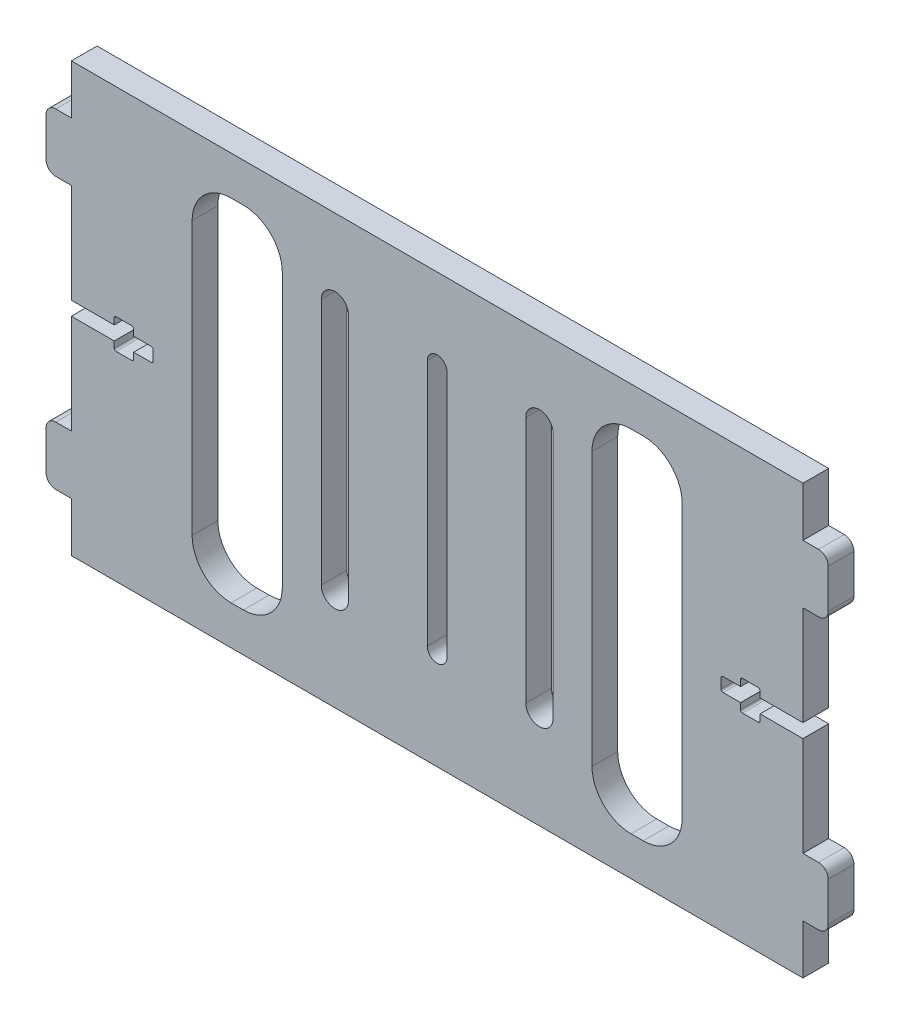
from build123d import *

# Parameters (mm, degrees)
BOSS_EXTRUDE1_DEPTH = 6.6


with BuildPart() as part:
    # Model → Boss-Extrude1 (new body)
    with BuildSketch(Plane.XY):
        with BuildLine():
            Line((72.9, 1.275), (72.9, -1.275))
            ThreePointArc((72.9, -1.275), (73.046446609, -1.628553391), (73.4, -1.775))
            Line((73.4, -1.775), (77.9, -1.775))
            Line((77.9, -1.775), (77.9, -3.36))
            ThreePointArc((77.9, -3.36), (78.046446609, -3.713553391), (78.4, -3.86))
            Line((78.4, -3.86), (82.4, -3.86))
            ThreePointArc((82.4, -3.86), (82.753553391, -3.713553391), (82.9, -3.36))
            Line((82.9, -3.36), (82.9, -1.775))
            Line((82.9, -1.775), (93.9, -1.775))
            Line((93.9, -1.775), (93.9, -27.3))
            Line((93.9, -27.3), (97.9, -27.3))
            ThreePointArc((97.9, -27.3), (99.667766953, -28.032233047), (100.4, -29.8))
            Line((100.4, -29.8), (100.4, -39.8))
            ThreePointArc((100.4, -39.8), (99.667766953, -41.567766953), (97.9, -42.3))
            Line((97.9, -42.3), (93.9, -42.3))
            Line((93.9, -42.3), (93.9, -55))
            Line((93.9, -55), (-93.9, -55))
            Line((-93.9, -55), (-93.9, -42.3))
            Line((-93.9, -42.3), (-97.9, -42.3))
            ThreePointArc((-97.9, -42.3), (-99.667766953, -41.567766953), (-100.4, -39.8))
            Line((-100.4, -39.8), (-100.4, -29.8))
            ThreePointArc((-100.4, -29.8), (-99.667766953, -28.032233047), (-97.9, -27.3))
            Line((-97.9, -27.3), (-93.9, -27.3))
            Line((-93.9, -27.3), (-93.9, -1.775))
            Line((-93.9, -1.775), (-82.9, -1.775))
            Line((-82.9, -1.775), (-82.9, -3.36))
            ThreePointArc((-82.9, -3.36), (-82.753553391, -3.713553391), (-82.4, -3.86))
            Line((-82.4, -3.86), (-78.4, -3.86))
            ThreePointArc((-78.4, -3.86), (-78.046446609, -3.713553391), (-77.9, -3.36))
            Line((-77.9, -3.36), (-77.9, -1.775))
            Line((-77.9, -1.775), (-73.4, -1.775))
            ThreePointArc((-73.4, -1.775), (-73.046446609, -1.628553391), (-72.9, -1.275))
            Line((-72.9, -1.275), (-72.9, 1.275))
            ThreePointArc((-72.9, 1.275), (-73.046446609, 1.628553391), (-73.4, 1.775))
            Line((-73.4, 1.775), (-77.9, 1.775))
            Line((-77.9, 1.775), (-77.9, 3.36))
            ThreePointArc((-77.9, 3.36), (-78.046446609, 3.713553391), (-78.4, 3.86))
            Line((-78.4, 3.86), (-82.4, 3.86))
            ThreePointArc((-82.4, 3.86), (-82.753553391, 3.713553391), (-82.9, 3.36))
            Line((-82.9, 3.36), (-82.9, 1.775))
            Line((-82.9, 1.775), (-93.9, 1.775))
            Line((-93.9, 1.775), (-93.9, 27.3))
            Line((-93.9, 27.3), (-97.9, 27.3))
            ThreePointArc((-97.9, 27.3), (-99.667766953, 28.032233047), (-100.4, 29.8))
            Line((-100.4, 29.8), (-100.4, 39.8))
            ThreePointArc((-100.4, 39.8), (-99.667766953, 41.567766953), (-97.9, 42.3))
            Line((-97.9, 42.3), (-93.9, 42.3))
            Line((-93.9, 42.3), (-93.9, 55))
            Line((-93.9, 55), (93.9, 55))
            Line((93.9, 55), (93.9, 42.3))
            Line((93.9, 42.3), (97.9, 42.3))
            ThreePointArc((97.9, 42.3), (99.667766953, 41.567766953), (100.4, 39.8))
            Line((100.4, 39.8), (100.4, 29.8))
            ThreePointArc((100.4, 29.8), (99.667766953, 28.032233047), (97.9, 27.3))
            Line((97.9, 27.3), (93.9, 27.3))
            Line((93.9, 27.3), (93.9, 1.775))
            Line((93.9, 1.775), (82.9, 1.775))
            Line((82.9, 1.775), (82.9, 3.36))
            ThreePointArc((82.9, 3.36), (82.753553391, 3.713553391), (82.4, 3.86))
            Line((82.4, 3.86), (78.4, 3.86))
            ThreePointArc((78.4, 3.86), (78.046446609, 3.713553391), (77.9, 3.36))
            Line((77.9, 3.36), (77.9, 1.775))
            Line((77.9, 1.775), (73.4, 1.775))
            ThreePointArc((73.4, 1.775), (73.046446609, 1.628553391), (72.9, 1.275))
        make_face()
        with BuildLine():
            Line((29.75, 34.05), (29.75, -29.45))
            ThreePointArc((29.75, -29.45), (26.25, -32.95), (22.75, -29.45))
            Line((22.75, -29.45), (22.75, 34.05))
            ThreePointArc((22.75, 34.05), (26.25, 37.55), (29.75, 34.05))
        make_face(mode=Mode.SUBTRACT)
        with BuildLine():
            Line((-29.75, 34.05), (-29.75, -29.45))
            ThreePointArc((-29.75, -29.45), (-26.25, -32.95), (-22.75, -29.45))
            Line((-22.75, -29.45), (-22.75, 34.05))
            ThreePointArc((-22.75, 34.05), (-26.25, 37.55), (-29.75, 34.05))
        make_face(mode=Mode.SUBTRACT)
        with BuildLine():
            Line((2.54, -29.45), (2.54, 34.05))
            ThreePointArc((2.54, 34.05), (0, 36.59), (-2.54, 34.05))
            Line((-2.54, 34.05), (-2.54, -29.45))
            ThreePointArc((-2.54, -29.45), (0, -31.99), (2.54, -29.45))
        make_face(mode=Mode.SUBTRACT)
        with BuildLine():
            Line((-39.75, -35), (-39.75, 35))
            ThreePointArc((-39.75, 35), (-42.678932188, 42.071067812), (-49.75, 45))
            Line((-49.75, 45), (-52.9, 45))
            ThreePointArc((-52.9, 45), (-59.971067812, 42.071067812), (-62.9, 35))
            Line((-62.9, 35), (-62.9, -35))
            ThreePointArc((-62.9, -35), (-59.971067812, -42.071067812), (-52.9, -45))
            Line((-52.9, -45), (-49.75, -45))
            ThreePointArc((-49.75, -45), (-42.678932188, -42.071067812), (-39.75, -35))
        make_face(mode=Mode.SUBTRACT)
        with BuildLine():
            Line((62.9, -35), (62.9, 35))
            ThreePointArc((62.9, 35), (59.971067812, 42.071067812), (52.9, 45))
            Line((52.9, 45), (49.75, 45))
            ThreePointArc((49.75, 45), (42.678932188, 42.071067812), (39.75, 35))
            Line((39.75, 35), (39.75, -35))
            ThreePointArc((39.75, -35), (42.678932188, -42.071067812), (49.75, -45))
            Line((49.75, -45), (52.9, -45))
            ThreePointArc((52.9, -45), (59.971067812, -42.071067812), (62.9, -35))
        make_face(mode=Mode.SUBTRACT)
    extrude(amount=BOSS_EXTRUDE1_DEPTH)


solid = part.part
